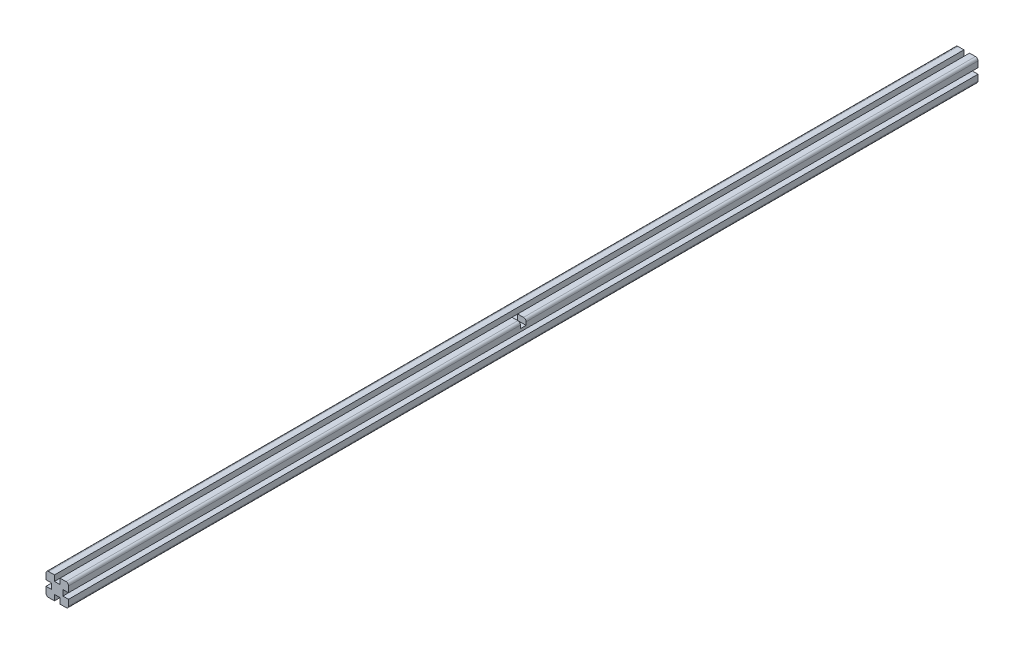
from build123d import *

# Parameters (mm, degrees)
BOSS_EXTRUDE1_DEPTH             = 1615
SCHNITT_LINEAR_AUSTRAGEN1_REACH = 1617.619
SKIZZE1_W                       = 10
SKIZZE1_H                       = 10


with BuildPart() as part:
    # Sketch1 → Boss-Extrude1 (new body)
    with BuildSketch(Plane.XY):
        with BuildLine():
            Line((-15.5, -20), (-5, -20))
            Line((-5, -20), (-5, -10))
            Line((-5, -10), (5, -10))
            Line((5, -10), (5, -20))
            Line((5, -20), (15.5, -20))
            ThreePointArc((15.5, -20), (18.681980515, -18.681980515), (20, -15.5))
            Line((20, -15.5), (20, -5))
            Line((20, -5), (10, -5))
            Line((10, -5), (10, 5))
            Line((10, 5), (20, 5))
            Line((20, 5), (20, 15.5))
            ThreePointArc((20, 15.5), (18.681980515, 18.681980515), (15.5, 20))
            Line((15.5, 20), (5, 20))
            Line((5, 20), (5, 10))
            Line((5, 10), (-5, 10))
            Line((-5, 10), (-5, 20))
            Line((-5, 20), (-8, 20))
            Line((-8, 20), (-15, 20))
            Line((-15, 20), (-15.5, 20))
            ThreePointArc((-15.5, 20), (-18.681980515, 18.681980515), (-20, 15.5))
            Line((-20, 15.5), (-20, 5))
            Line((-20, 5), (-10, 5))
            Line((-10, 5), (-10, -5))
            Line((-10, -5), (-20, -5))
            Line((-20, -5), (-20, -15.5))
            ThreePointArc((-20, -15.5), (-18.681980515, -18.681980515), (-15.5, -20))
        make_face()
    extrude(amount=BOSS_EXTRUDE1_DEPTH)

    # Skizze1 → Schnitt-Linear austragen1 (cut, up to next)
    with BuildSketch(Plane(origin=(20, 0, 0), x_dir=(0, 0, -1), z_dir=(1, 0, 0)), mode=Mode.PRIVATE) as schnitt_linear_austragen1_sk1:
        with Locations((-807.5, 15)):
            Rectangle(SKIZZE1_W, SKIZZE1_H)
    schnitt_linear_austragen1_tool1 = extrude(schnitt_linear_austragen1_sk1.sketch, amount=-SCHNITT_LINEAR_AUSTRAGEN1_REACH, mode=Mode.PRIVATE) & part.part
    add(schnitt_linear_austragen1_tool1.solids().sort_by_distance((20, 15, 807.5))[0], mode=Mode.SUBTRACT)


solid = part.part
